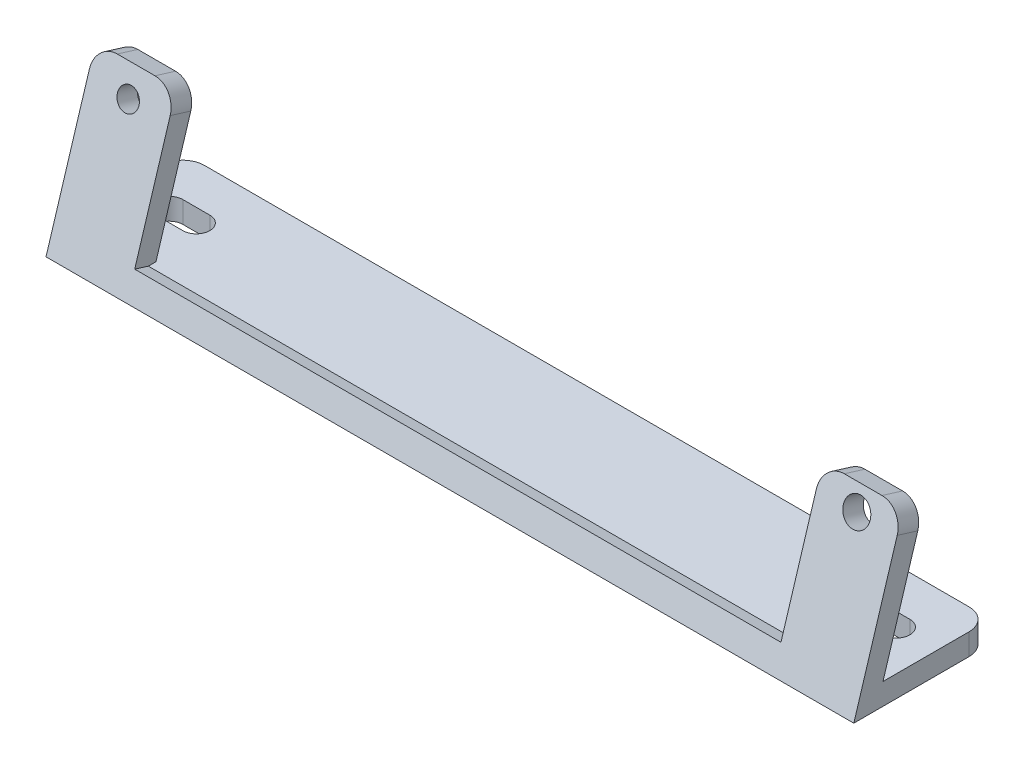
from build123d import *

# Parameters (mm, degrees)
SKETCH1_W           = 150
SKETCH1_H           = 20
BOSS_EXTRUDE1_DEPTH = 4
BOSS_EXTRUDE3_DEPTH = 150
SKETCH4_R           = 2.005
SKETCH4_R_2         = 2.5
SKETCH4_W           = 120
SKETCH4_H           = 26.389234781
CUT_EXTRUDE1_DEPTH  = 10
FILLET1_R           = 4
BOSS_EXTRUDE4_DEPTH = 150
CUT_EXTRUDE4_DEPTH  = 10


with BuildPart() as part:
    # Sketch1 → Boss-Extrude1 (new body)
    with BuildSketch(Plane(origin=(0, 0, 0), x_dir=(1, 0, 0), z_dir=(0, 1, 0))):
        Rectangle(SKETCH1_W, SKETCH1_H)
        with BuildLine():
            Line((-67.5, 2.5), (-62.5, 2.5))
            ThreePointArc((-62.5, 2.5), (-60, 0), (-62.5, -2.5))
            Line((-62.5, -2.5), (-67.5, -2.5))
            ThreePointArc((-67.5, -2.5), (-70, 0), (-67.5, 2.5))
        make_face(mode=Mode.SUBTRACT)
        with BuildLine():
            Line((62.5, 2.5), (67.5, 2.5))
            ThreePointArc((67.5, 2.5), (70, 0), (67.5, -2.5))
            Line((67.5, -2.5), (62.5, -2.5))
            ThreePointArc((62.5, -2.5), (60, 0), (62.5, 2.5))
        make_face(mode=Mode.SUBTRACT)
    extrude(amount=BOSS_EXTRUDE1_DEPTH)

    # Sketch3 → Boss-Extrude3 (add)
    with BuildSketch(Plane(origin=(75, 0, 0), x_dir=(0, 0, -1), z_dir=(1, 0, 0))):
        Polygon((-10, 0), (-15.416556228, 0), (-6.181619296, 30), (-2.358652574, 28.823171448), (-10, 4), align=None)
    extrude(amount=-BOSS_EXTRUDE3_DEPTH)

    # Sketch4 → Cut-Extrude1 (cut)
    with BuildSketch(Plane(origin=(0, 4.334920159, 14.082132419), x_dir=(1, 0, 0), z_dir=(0, 0.2942071381037286, 0.9557416805229401))):
        with Locations(Location((-67.5, 21.853573894, 0), (0, 0, 270))):
            Circle(SKETCH4_R)
        with Locations(Location((67.5, 22.843573894, 0), (0, 0, 270))):
            Circle(SKETCH4_R_2)
        with Locations((0, 13.658956504)):
            Rectangle(SKETCH4_W, SKETCH4_H)
    extrude(amount=-CUT_EXTRUDE1_DEPTH, mode=Mode.SUBTRACT)

    # Fillet1
    fillet1_edges = [part.edges().sort_by_distance(p)[0] for p in [
        (75, 29.411585724, 4.270135935),
        (-75, 29.411585724, 4.270135935),
        (-60, 29.411585724, 4.270135935),
        (60, 29.411585724, 4.270135935),
        (-75, 2, -10),
        (75, 2, -10),
    ]]
    fillet(fillet1_edges, radius=FILLET1_R)

    # Sketch5 → Boss-Extrude4 (add)
    with BuildSketch(Plane(origin=(75, 0, 0), x_dir=(0, 0, -1), z_dir=(1, 0, 0))):
        Polygon((6, 4), (6, 0), (-15.416556228, 0), (-14.185231304, 4), align=None)
    extrude(amount=-BOSS_EXTRUDE4_DEPTH)

    # Sketch7 → Cut-Extrude4 (cut)
    with BuildSketch(Plane.XZ):
        with BuildLine():
            Line((-62.5, -2.5), (-67.5, -2.5))
            ThreePointArc((-67.5, -2.5), (-70, 0), (-67.5, 2.5))
            Line((-67.5, 2.5), (-62.5, 2.5))
            ThreePointArc((-62.5, 2.5), (-60, 0), (-62.5, -2.5))
        make_face()
        with BuildLine():
            Line((62.5, 2.5), (67.5, 2.5))
            ThreePointArc((67.5, 2.5), (70, 0), (67.5, -2.5))
            Line((67.5, -2.5), (62.5, -2.5))
            ThreePointArc((62.5, -2.5), (60, 0), (62.5, 2.5))
        make_face()
    extrude(amount=-CUT_EXTRUDE4_DEPTH, mode=Mode.SUBTRACT)


solid = part.part
